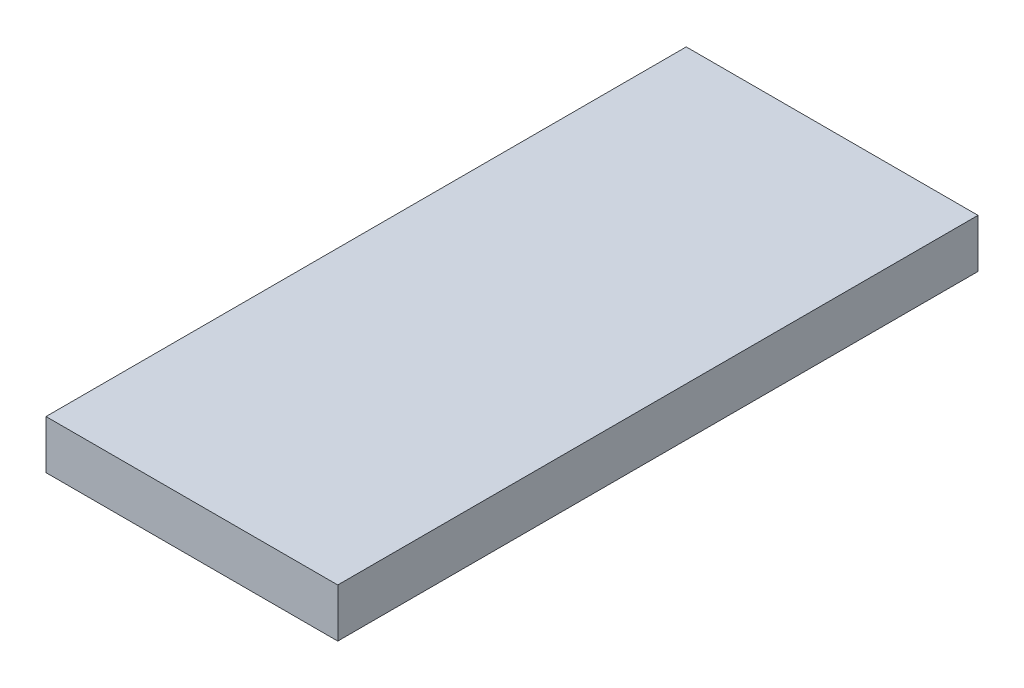
from build123d import *

# Parameters (mm, degrees)
SKETCH1_W           = 18
SKETCH1_H           = 39.5
BOSS_EXTRUDE1_DEPTH = 3


with BuildPart() as part:
    # Sketch1 → Boss-Extrude1 (new body)
    with BuildSketch(Plane(origin=(0, 0, 0), x_dir=(1, 0, 0), z_dir=(0, 1, 0))):
        with Locations((9, 19.75)):
            Rectangle(SKETCH1_W, SKETCH1_H)
    extrude(amount=BOSS_EXTRUDE1_DEPTH)


solid = part.part
